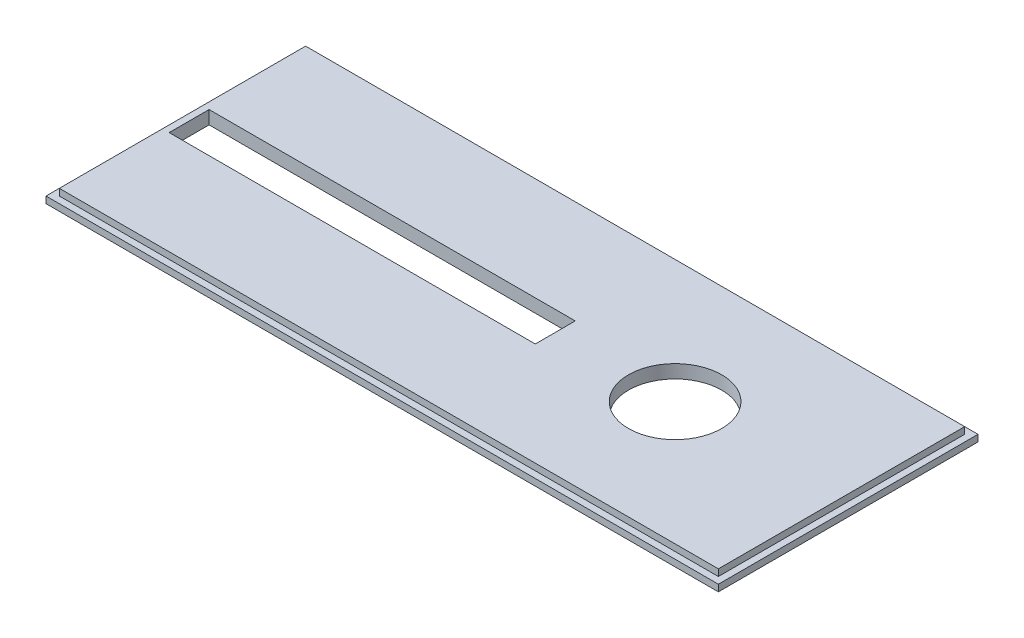
from build123d import *

# Parameters (mm, degrees)
SKETCH2_W           = 101
SKETCH2_H           = 39
BOSS_EXTRUDE1_DEPTH = 1
SKETCH3_W           = 99
SKETCH3_H           = 37
BOSS_EXTRUDE2_DEPTH = 1
SKETCH4_R           = 7
CUT_EXTRUDE1_DEPTH  = 2
CUT_EXTRUDE2_DEPTH  = 0.2


with BuildPart() as part:
    # Sketch2 → Boss-Extrude1 (new body)
    with BuildSketch(Plane(origin=(0, 0, 0), x_dir=(1, 0, 0), z_dir=(0, 1, 0))):
        with Locations((50.5, 19.5)):
            Rectangle(SKETCH2_W, SKETCH2_H)
    extrude(amount=BOSS_EXTRUDE1_DEPTH)

    # Sketch3 → Boss-Extrude2 (add)
    with BuildSketch(Plane(origin=(0, 1, 0), x_dir=(1, 0, 0), z_dir=(0, 1, 0))):
        with Locations((50.5, 19.5)):
            Rectangle(SKETCH3_W, SKETCH3_H)
    extrude(amount=BOSS_EXTRUDE2_DEPTH)

    # Sketch4 → Cut-Extrude1 (cut)
    with BuildSketch(Plane(origin=(0, 2, 0), x_dir=(1, 0, 0), z_dir=(0, 1, 0))):
        with Locations(Location((75, 19.5, 0), (0, 0, 270))):
            Circle(SKETCH4_R)
        Polygon((2, 19.5), (2, 22.5), (57, 22.5), (57, 16.5), (2, 16.5), align=None)
    extrude(amount=-CUT_EXTRUDE1_DEPTH, mode=Mode.SUBTRACT)

    # Sketch5 → Cut-Extrude2 (cut)
    # profile 1 of 13: a face of its own
    with BuildSketch(Plane.XZ):
        Polygon((5.437038124, -7.674955241), (7.777582996, -7.674955241), (7.777582996, -8.132887933), (5.945852227, -8.132887933), (5.945852227, -9.252278959), (7.777582996, -9.252278959), (7.777582996, -9.710211651), (5.945852227, -9.710211651), (5.945852227, -11.185772549), (7.777582996, -11.185772549), (7.777582996, -11.643705241), (5.437038124, -11.643705241), align=None)
    # profile 2 of 13: a face of its own
    with BuildSketch(Plane.XZ):
        with BuildLine():
            Line((12.153384278, -8.41273569), (11.74792304, -8.692583446))
            add(Edge.make_bspline(
                [(11.74792304, -8.692583446), (11.699360519, -8.639390419), (11.604293587, -8.535258717), (11.447741833, -8.398852612), (11.283903862, -8.284045488), (11.112548974, -8.191219567), (10.933495748, -8.118551578), (10.745802345, -8.068059473), (10.549272674, -8.036942328), (10.415317675, -8.033088084), (10.347094214, -8.031125113)],
                knots=[0, 0, 0, 0, 1.078723025, 2.111729107, 3.104379151, 4.071093171, 5.02612831, 5.993405043, 6.978038489, 8, 8, 8, 8], degree=3))
            add(Edge.make_bspline(
                [(10.347094214, -8.031125113), (10.311552887, -8.031637396), (10.240846985, -8.032656533), (10.136069164, -8.043861225), (10.032893996, -8.059197322), (9.931418553, -8.082498939), (9.831823107, -8.112961451), (9.733429062, -8.148288704), (9.637726478, -8.192045026), (9.543786966, -8.240679904), (9.453020008, -8.295383363), (9.367525595, -8.356141299), (9.285748273, -8.420238831), (9.210000019, -8.490706494), (9.139589571, -8.566307555), (9.072974566, -8.646090641), (9.0118387, -8.731093502), (8.956416956, -8.821061306), (8.905863851, -8.914653562), (8.863438944, -9.012556212), (8.826606094, -9.113108419), (8.796039794, -9.216833773), (8.77343275, -9.324046456), (8.756669942, -9.434454634), (8.745927793, -9.547813754), (8.744865472, -9.624590343), (8.744329791, -9.663305351)],
                knots=[0, 0, 0, 0, 1.002068956, 1.993515617, 2.969284448, 3.943018425, 4.926742606, 5.905741285, 6.889351865, 7.892340394, 8.888397413, 9.875523532, 10.849114049, 11.817064186, 12.790109362, 13.76151668, 14.746886598, 15.740472426, 16.740336546, 17.744438579, 18.747064952, 19.759451636, 20.791569268, 21.834966327, 22.908270136, 24, 24, 24, 24], degree=3))
            add(Edge.make_bspline(
                [(8.744329791, -9.663305351), (8.745556182, -9.721420952), (8.747956881, -9.835184004), (8.771160957, -10.001761733), (8.807367507, -10.160504507), (8.858262996, -10.311399788), (8.924025997, -10.45427616), (9.004481465, -10.588898893), (9.100092364, -10.715596236), (9.20927368, -10.832730533), (9.328291627, -10.940229594), (9.45728559, -11.032204597), (9.591838383, -11.112072765), (9.734609332, -11.175487352), (9.883580968, -11.225921905), (10.039906248, -11.261647802), (10.203099575, -11.283568031), (10.314429168, -11.286199515), (10.370944875, -11.287535369)],
                knots=[0, 0, 0, 0, 1.083728652, 2.12143175, 3.131304262, 4.117911469, 5.086904967, 6.060353746, 7.03835, 8.042493243, 9.043967071, 10.025107856, 10.993520914, 11.958418665, 12.934074928, 13.923564625, 14.94591178, 16, 16, 16, 16], degree=3))
            add(Edge.make_bspline(
                [(10.370944875, -11.287535369), (10.436527525, -11.285607548), (10.566057471, -11.281799979), (10.756515139, -11.24972865), (10.94002588, -11.197927791), (11.116787832, -11.124904734), (11.28694527, -11.031376994), (11.449698824, -10.916625442), (11.60595556, -10.781687717), (11.700933467, -10.67873542), (11.749513084, -10.626077036)],
                knots=[0, 0, 0, 0, 0.996377973, 1.967910503, 2.926842387, 3.889624876, 4.868586907, 5.872161968, 6.91164629, 8, 8, 8, 8], degree=3))
            Line((11.749513084, -10.626077036), (12.153384278, -10.904334748))
            add(Edge.make_bspline(
                [(12.153384278, -10.904334748), (12.127239388, -10.937490895), (12.075292891, -11.003367848), (11.991403183, -11.096548242), (11.903287567, -11.184184035), (11.810078328, -11.26546235), (11.711875191, -11.340304133), (11.609138281, -11.409575972), (11.501966323, -11.473167687), (11.390417869, -11.530398804), (11.275128399, -11.58162139), (11.15586253, -11.624756805), (11.033763304, -11.662809309), (10.90775412, -11.692600207), (10.778326885, -11.716744892), (10.645281148, -11.732950941), (10.509198658, -11.743919835), (10.41734333, -11.744948471), (10.370944875, -11.745468062)],
                knots=[0, 0, 0, 0, 0.990136069, 1.967271632, 2.938597646, 3.903378639, 4.8655934, 5.832714132, 6.808088679, 7.786607084, 8.77175572, 9.76479442, 10.759640537, 11.769709565, 12.799869661, 13.846050076, 14.911985293, 16, 16, 16, 16], degree=3))
            add(Edge.make_bspline(
                [(10.370944875, -11.745468062), (10.328259188, -11.745178779), (10.244117959, -11.744608552), (10.119769875, -11.735027673), (9.998716951, -11.722072103), (9.881285482, -11.702635602), (9.766921348, -11.679360112), (9.656558027, -11.648499585), (9.548698199, -11.614075179), (9.444911232, -11.572443671), (9.344414578, -11.52614739), (9.246854702, -11.47540747), (9.153191397, -11.418157061), (9.063346697, -11.354952211), (8.976263065, -11.287384055), (8.892821252, -11.213948165), (8.812153072, -11.135579686), (8.762259922, -11.079043915), (8.737174592, -11.050618803)],
                knots=[0, 0, 0, 0, 1.116169561, 2.200172621, 3.260333751, 4.299600589, 5.312386579, 6.311224183, 7.295427787, 8.272379731, 9.233840239, 10.188782295, 11.146938977, 12.102635432, 13.060741968, 14.028403985, 15.00871894, 16, 16, 16, 16], degree=3))
            add(Edge.make_bspline(
                [(8.737174592, -11.050618803), (8.696961878, -11.00126552), (8.617253588, -10.903439103), (8.515664104, -10.744427439), (8.428040569, -10.578929216), (8.358420201, -10.4045865), (8.303390855, -10.223455403), (8.263282112, -10.034983227), (8.240171984, -9.83852527), (8.237085127, -9.704971728), (8.235515688, -9.637069624)],
                knots=[0, 0, 0, 0, 0.995996121, 1.974230005, 2.94855815, 3.923972302, 4.908363682, 5.909282248, 6.937024559, 8, 8, 8, 8], degree=3))
            add(Edge.make_bspline(
                [(8.235515688, -9.637069624), (8.237287514, -9.56568592), (8.240773471, -9.425242939), (8.270131706, -9.219077395), (8.317967332, -9.021860036), (8.383716139, -8.832739826), (8.470840046, -8.65326405), (8.574740148, -8.481113514), (8.700391258, -8.319495823), (8.841610149, -8.167011424), (8.996980492, -8.027460943), (9.164768736, -7.906448105), (9.341391793, -7.803036582), (9.527500116, -7.718323623), (9.723597986, -7.652698146), (9.929361218, -7.607298131), (10.144348626, -7.578550655), (10.290820035, -7.574999896), (10.365379721, -7.573192421)],
                knots=[0, 0, 0, 0, 1.034323922, 2.034967744, 3.011348252, 3.972313581, 4.931003742, 5.898099022, 6.881526582, 7.89265862, 8.907395938, 9.903191422, 10.886146247, 11.869423756, 12.861842533, 13.877618994, 14.91962492, 16, 16, 16, 16], degree=3))
            add(Edge.make_bspline(
                [(10.365379721, -7.573192421), (10.412305032, -7.57373577), (10.505212766, -7.574811551), (10.642959122, -7.585440767), (10.777209875, -7.602887639), (10.907991833, -7.62691987), (11.035692091, -7.656616524), (11.159634798, -7.695338439), (11.280522258, -7.739573282), (11.397540742, -7.790644657), (11.510403101, -7.847459126), (11.617829797, -7.911553126), (11.720563127, -7.980466709), (11.817784213, -8.055636256), (11.91014105, -8.13582237), (11.997182587, -8.221947993), (12.078455321, -8.314362414), (12.128324333, -8.379834807), (12.153384278, -8.41273569)],
                knots=[0, 0, 0, 0, 1.097463626, 2.172875475, 3.229307817, 4.262776093, 5.282168658, 6.293918414, 7.298043722, 8.291879901, 9.278790577, 10.251524626, 11.216027204, 12.170719329, 13.124142787, 14.075306658, 15.032812027, 16, 16, 16, 16], degree=3))
        make_face()
    # profile 3 of 13: a face of its own
    with BuildSketch(Plane.XZ):
        Polygon((12.967486842, -7.674955241), (15.308031714, -7.674955241), (15.308031714, -8.132887933), (13.476300945, -8.132887933), (13.476300945, -9.252278959), (15.308031714, -9.252278959), (15.308031714, -9.710211651), (13.476300945, -9.710211651), (13.476300945, -11.185772549), (15.308031714, -11.185772549), (15.308031714, -11.643705241), (12.967486842, -11.643705241), align=None)
    # profile 4 of 13: a face of its own
    with BuildSketch(Plane.XZ):
        Polygon((18.057217912, -7.674955241), (18.920611842, -7.674955241), (18.920611842, -11.643705241), (18.411797739, -11.643705241), (18.411797739, -8.132887933), (17.801220816, -8.132887933), align=None)
    # profile 5 of 13: a face of its own
    with BuildSketch(Plane.XZ):
        with BuildLine():
            Line((21.252411471, -11.745468062), (20.873185961, -11.510936561))
            Line((20.873185961, -11.510936561), (21.932950334, -9.977339055))
            add(Edge.make_bspline(
                [(21.932950334, -9.977339055), (21.907321436, -9.983308805), (21.853791418, -9.995777575), (21.768122152, -10.007046591), (21.674695895, -10.014271073), (21.609656943, -10.01508087), (21.57598544, -10.015500113)],
                knots=[0, 0, 0, 0, 0.876990432, 1.831733655, 2.877460594, 4, 4, 4, 4], degree=3))
            add(Edge.make_bspline(
                [(21.57598544, -10.015500113), (21.534066502, -10.014380789), (21.451249951, -10.012169414), (21.329528534, -9.996148983), (21.212572572, -9.969143164), (21.100873334, -9.930606739), (20.993610629, -9.88205586), (20.891356502, -9.822016104), (20.794212684, -9.750794237), (20.702693414, -9.670196442), (20.618558378, -9.582215186), (20.546251611, -9.486700388), (20.483391825, -9.387444849), (20.433538476, -9.282229309), (20.392889835, -9.172878855), (20.365657982, -9.057774015), (20.34829361, -8.93771668), (20.346304321, -8.855889926), (20.345291329, -8.814221818)],
                knots=[0, 0, 0, 0, 1.049645559, 2.073717244, 3.068620023, 4.050868799, 5.0280146, 6.012614837, 7.014861962, 8.040029866, 9.063477688, 10.05771615, 11.035582925, 12.000321245, 12.968227545, 13.951753526, 14.956984712, 16, 16, 16, 16], degree=3))
            add(Edge.make_bspline(
                [(20.345291329, -8.814221818), (20.347189662, -8.757361494), (20.350918306, -8.645678252), (20.38296114, -8.482785474), (20.434718634, -8.328597815), (20.507617106, -8.184309882), (20.598950816, -8.050761814), (20.709872778, -7.932032079), (20.83707772, -7.826394297), (20.980129847, -7.737036424), (21.13424013, -7.663956932), (21.295773265, -7.611176947), (21.462873815, -7.579014131), (21.576109559, -7.575144373), (21.633227026, -7.573192421)],
                knots=[0, 0, 0, 0, 1.026406161, 2.016034366, 2.986473729, 3.956357911, 4.927092453, 5.899372274, 6.881969593, 7.906050784, 8.938290869, 9.955669438, 10.968815142, 12, 12, 12, 12], degree=3))
            add(Edge.make_bspline(
                [(21.633227026, -7.573192421), (21.692998628, -7.575063371), (21.811029408, -7.57875793), (21.983989293, -7.611628751), (22.149441979, -7.665146202), (22.305172852, -7.739868115), (22.449009432, -7.831751581), (22.577564084, -7.939102227), (22.686787834, -8.063557914), (22.777519008, -8.200572101), (22.849712533, -8.346283216), (22.901967007, -8.497128364), (22.934255266, -8.651460594), (22.938248849, -8.755769536), (22.940243252, -8.807861641)],
                knots=[0, 0, 0, 0, 1.075354337, 2.123498557, 3.157086714, 4.198574184, 5.224335365, 6.223199331, 7.20350914, 8.194696859, 9.174135401, 10.123259326, 11.062751755, 12, 12, 12, 12], degree=3))
            add(Edge.make_bspline(
                [(22.940243252, -8.807861641), (22.938821916, -8.848454794), (22.935939031, -8.930789573), (22.918370652, -9.055614402), (22.886058511, -9.182241742), (22.851801583, -9.290124347), (22.815859835, -9.378943786), (22.784062602, -9.451069969), (22.745908117, -9.526687226), (22.702197115, -9.606576181), (22.655456972, -9.691746657), (22.600375434, -9.779634248), (22.542112685, -9.872930183), (22.499989003, -9.93558914), (22.47833545, -9.967798791)],
                knots=[0, 0, 0, 0, 1.152952784, 2.338525269, 3.5705256, 4.860373011, 5.549303084, 6.290464991, 7.098171277, 7.95341765, 8.876586292, 9.856184562, 10.897978041, 12, 12, 12, 12], degree=3))
            Line((22.47833545, -9.967798791), (21.252411471, -11.745468062))
        make_face()
        with BuildLine():
            add(Edge.make_bspline(
                [(21.645152357, -9.557567421), (21.673817653, -9.557145604), (21.729790827, -9.556321946), (21.81165288, -9.544331591), (21.889348256, -9.527145539), (21.963349492, -9.503750799), (22.032017811, -9.47093043), (22.097591041, -9.433293973), (22.158392291, -9.387300555), (22.214352882, -9.335127641), (22.265007028, -9.278022585), (22.309710905, -9.217759272), (22.347246387, -9.154252444), (22.378948852, -9.088331352), (22.401215158, -9.018491912), (22.419357262, -8.946693708), (22.429815715, -8.871506652), (22.430885449, -8.820348016), (22.43142915, -8.794346267)],
                knots=[0, 0, 0, 0, 1.121582496, 2.190053483, 3.232400525, 4.236647434, 5.220963389, 6.207028463, 7.192929689, 8.198944593, 9.198677044, 10.178386704, 11.132364257, 12.084081197, 13.035798136, 13.997310019, 14.982118228, 16, 16, 16, 16], degree=3))
            add(Edge.make_bspline(
                [(22.43142915, -8.794346267), (22.430625856, -8.768599497), (22.42903657, -8.717660487), (22.41759055, -8.642812879), (22.399405551, -8.570482105), (22.37315519, -8.501433069), (22.33906878, -8.435196753), (22.297796248, -8.371788843), (22.24898018, -8.311149471), (22.193554121, -8.254258579), (22.13308337, -8.202465814), (22.068826295, -8.156469144), (22.001229587, -8.117540127), (21.930296828, -8.085290431), (21.855890975, -8.061860501), (21.778825091, -8.04423237), (21.698514689, -8.032467853), (21.643604239, -8.031577153), (21.615736542, -8.031125113)],
                knots=[0, 0, 0, 0, 0.99485033, 1.968273718, 2.919732649, 3.872789051, 4.816442427, 5.793738012, 6.791904607, 7.820456554, 8.859208763, 9.865331505, 10.8702544, 11.869681439, 12.870576991, 13.87935517, 14.923747887, 16, 16, 16, 16], degree=3))
            add(Edge.make_bspline(
                [(21.615736542, -8.031125113), (21.590783972, -8.031641093), (21.541452008, -8.0326612), (21.468855889, -8.043659813), (21.398372879, -8.059930441), (21.330506253, -8.084476474), (21.26426816, -8.114119811), (21.201273197, -8.152477168), (21.139714676, -8.195763257), (21.082393861, -8.24661391), (21.029171653, -8.301920832), (20.981991361, -8.361235767), (20.943169375, -8.424891707), (20.909479096, -8.491141735), (20.88571597, -8.562355787), (20.866771314, -8.636360516), (20.856724486, -8.714307942), (20.854990746, -8.767291048), (20.854105432, -8.794346267)],
                knots=[0, 0, 0, 0, 0.997303855, 1.971699086, 2.930693632, 3.886166766, 4.85379267, 5.828187901, 6.831221175, 7.860297234, 8.887406069, 9.898917088, 10.884320193, 11.865609815, 12.864602205, 13.880104296, 14.917499442, 16, 16, 16, 16], degree=3))
            add(Edge.make_bspline(
                [(20.854105432, -8.794346267), (20.854886991, -8.821419292), (20.8564186, -8.874473811), (20.867904411, -8.951950617), (20.885884671, -9.025973371), (20.912818148, -9.095896044), (20.945000462, -9.163782423), (20.98695675, -9.226775917), (21.034646306, -9.287368342), (21.090503549, -9.342039457), (21.150069238, -9.393012402), (21.214032862, -9.436252202), (21.279424737, -9.47460682), (21.348032218, -9.504222509), (21.418516852, -9.528901412), (21.491943647, -9.54501135), (21.567700608, -9.556034687), (21.619140958, -9.557052667), (21.645152357, -9.557567421)],
                knots=[0, 0, 0, 0, 1.061595758, 2.080390103, 3.066193108, 4.043187242, 5.014857721, 6.006725919, 7.00516375, 8.034247875, 9.067105391, 10.076308362, 11.058817295, 12.036198478, 13.002683705, 13.983651619, 14.980410447, 16, 16, 16, 16], degree=3))
        make_face(mode=Mode.SUBTRACT)
    # profile 6 of 13: a face of its own
    with BuildSketch(Plane.XZ):
        with BuildLine():
            Line((25.27522297, -7.573192421), (25.670348921, -7.810108987))
            Line((25.670348921, -7.810108987), (24.606609438, -9.339731383))
            add(Edge.make_bspline(
                [(24.606609438, -9.339731383), (24.625864046, -9.334060058), (24.667576881, -9.321773803), (24.737134569, -9.310351224), (24.817717093, -9.304595073), (24.875051986, -9.303658407), (24.905537723, -9.303160369)],
                knots=[0, 0, 0, 0, 0.796048766, 1.724545677, 2.790110166, 4, 4, 4, 4], degree=3))
            add(Edge.make_bspline(
                [(24.905537723, -9.303160369), (24.949052713, -9.304194241), (25.034558112, -9.306225761), (25.159718981, -9.32324683), (25.279250166, -9.351190529), (25.393389152, -9.390071253), (25.50179475, -9.440675425), (25.605301002, -9.500904956), (25.701868978, -9.574371505), (25.792180068, -9.657239914), (25.875536293, -9.746723271), (25.947132455, -9.842941648), (26.008818075, -9.942448188), (26.059640859, -10.046358223), (26.097413524, -10.155219448), (26.125501333, -10.267700486), (26.142699687, -10.384656345), (26.144737402, -10.464099551), (26.145772098, -10.504438665)],
                knots=[0, 0, 0, 0, 1.085768624, 2.13349656, 3.1458852, 4.145750037, 5.137155722, 6.127501693, 7.128940571, 8.158980511, 9.184145427, 10.176323106, 11.147419034, 12.102959344, 13.056918676, 14.017869493, 14.993527694, 16, 16, 16, 16], degree=3))
            add(Edge.make_bspline(
                [(26.145772098, -10.504438665), (26.143822457, -10.559444818), (26.139986871, -10.667659995), (26.108436778, -10.826125091), (26.058508706, -10.977705302), (25.987271545, -11.120925686), (25.89729959, -11.254901222), (25.786436315, -11.375431887), (25.656775703, -11.48275246), (25.510870171, -11.575739854), (25.351950915, -11.650937339), (25.184221329, -11.705353065), (25.009446303, -11.739121906), (24.890318326, -11.743335141), (24.83001063, -11.745468062)],
                knots=[0, 0, 0, 0, 0.981999396, 1.931915476, 2.875165147, 3.825883243, 4.780566088, 5.74908454, 6.740839944, 7.779754303, 8.832355466, 9.872951476, 10.923196738, 12, 12, 12, 12], degree=3))
            add(Edge.make_bspline(
                [(24.83001063, -11.745468062), (24.775278568, -11.743465884), (24.666825805, -11.739498527), (24.507512813, -11.708225967), (24.354438529, -11.657856762), (24.208908986, -11.588178003), (24.074750966, -11.49917067), (23.954289923, -11.393334759), (23.849080104, -11.271117343), (23.760631584, -11.133998348), (23.690445222, -10.985979876), (23.638832711, -10.831283407), (23.607768467, -10.671044226), (23.60373317, -10.562344175), (23.601701586, -10.507618753)],
                knots=[0, 0, 0, 0, 1.013919762, 2.009103873, 2.997048414, 3.994509061, 4.990420291, 5.971920342, 6.957603089, 7.969950955, 8.9872563, 9.986070715, 10.986080238, 12, 12, 12, 12], degree=3))
            add(Edge.make_bspline(
                [(23.601701586, -10.507618753), (23.603026135, -10.465686472), (23.605712342, -10.380647145), (23.624782554, -10.252077028), (23.655943133, -10.121223884), (23.692616704, -10.01127277), (23.728201678, -9.920410901), (23.761127088, -9.848646936), (23.797587944, -9.772909233), (23.838911258, -9.693978018), (23.886203094, -9.612574008), (23.937023731, -9.526861201), (23.993519039, -9.438415431), (24.033060785, -9.378374093), (24.053274102, -9.347681603)],
                knots=[0, 0, 0, 0, 1.194305989, 2.422071347, 3.694670561, 5.022004315, 5.720134447, 6.47362152, 7.270449589, 8.114647718, 9.010750929, 9.951985565, 10.953076949, 12, 12, 12, 12], degree=3))
            Line((24.053274102, -9.347681603), (25.27522297, -7.573192421))
        make_face()
        with BuildLine():
            add(Edge.make_bspline(
                [(24.826830542, -9.761093062), (24.802408825, -9.761615082), (24.754133584, -9.762646977), (24.683350835, -9.773515495), (24.615028831, -9.789982356), (24.549841927, -9.814049594), (24.487494273, -9.844365622), (24.428017353, -9.8813217), (24.371445559, -9.925443155), (24.31794224, -9.975526756), (24.26985972, -10.031400292), (24.226014478, -10.090178397), (24.190453084, -10.153972889), (24.161991286, -10.22139031), (24.138407518, -10.291953154), (24.121906611, -10.366525172), (24.112272861, -10.445087108), (24.111109761, -10.498581236), (24.110515688, -10.525904259)],
                knots=[0, 0, 0, 0, 1.000668136, 1.978054791, 2.929484158, 3.878303629, 4.821130496, 5.767956646, 6.743892455, 7.758622191, 8.767575263, 9.763037712, 10.760455477, 11.753542685, 12.760386935, 13.807023548, 14.879900473, 16, 16, 16, 16], degree=3))
            add(Edge.make_bspline(
                [(24.110515688, -10.525904259), (24.111032756, -10.552971353), (24.11204556, -10.605988913), (24.12277901, -10.683728667), (24.139960144, -10.757884033), (24.165124756, -10.828238968), (24.195841108, -10.895443652), (24.2345671, -10.958703185), (24.279931007, -11.018292076), (24.331366417, -11.07362889), (24.387621805, -11.123604874), (24.447297667, -11.166977161), (24.508204833, -11.205021235), (24.572339934, -11.23439194), (24.637834474, -11.258584091), (24.706157563, -11.275022473), (24.776386794, -11.285995265), (24.8241378, -11.287017963), (24.848296137, -11.287535369)],
                knots=[0, 0, 0, 0, 1.099969797, 2.154561419, 3.184363179, 4.189745603, 5.187708984, 6.183808971, 7.198903794, 8.22825443, 9.251098181, 10.253299465, 11.225387826, 12.165412448, 13.116428293, 14.059905273, 15.018461259, 16, 16, 16, 16], degree=3))
            add(Edge.make_bspline(
                [(24.848296137, -11.287535369), (24.875107524, -11.28709407), (24.927914897, -11.286224894), (25.00554086, -11.274241799), (25.08027545, -11.256897969), (25.152410119, -11.233566401), (25.220289902, -11.200792102), (25.285949099, -11.162614522), (25.348854786, -11.117447548), (25.407058788, -11.064852608), (25.460984269, -11.008336052), (25.5079056, -10.947723558), (25.548118222, -10.884524025), (25.580980965, -10.818534865), (25.605440435, -10.749227675), (25.624267559, -10.677543902), (25.63427257, -10.602505519), (25.636055938, -10.551635296), (25.636957996, -10.525904259)],
                knots=[0, 0, 0, 0, 1.054506433, 2.076942642, 3.08409574, 4.073807639, 5.053850104, 6.045100359, 7.061397357, 8.095844899, 9.129029121, 10.132772442, 11.10813953, 12.073918953, 13.02762105, 13.996719216, 14.986705996, 16, 16, 16, 16], degree=3))
            add(Edge.make_bspline(
                [(25.636957996, -10.525904259), (25.636168175, -10.499891586), (25.63461341, -10.448685535), (25.623057942, -10.373322361), (25.604900801, -10.300834898), (25.579421416, -10.231101416), (25.54585288, -10.164606664), (25.503749388, -10.101962475), (25.456251972, -10.040774625), (25.400600271, -9.984602117), (25.340923398, -9.931854752), (25.276123628, -9.886960282), (25.209216111, -9.847436256), (25.139002895, -9.815299394), (25.065174005, -9.791689766), (24.98857436, -9.774309974), (24.90882184, -9.762416034), (24.854435195, -9.761538477), (24.826830542, -9.761093062)],
                knots=[0, 0, 0, 0, 1.007406841, 1.98308429, 2.946696416, 3.898367138, 4.853354566, 5.824321577, 6.818405618, 7.849339281, 8.882723662, 9.899554728, 10.89792352, 11.890309722, 12.883757414, 13.89487152, 14.931514512, 16, 16, 16, 16], degree=3))
        make_face(mode=Mode.SUBTRACT)
    # profile 7 of 13: a face of its own
    with BuildSketch(Plane.XZ):
        Polygon((28.079265688, -7.674955241), (28.591259879, -7.674955241), (29.857729981, -10.719094614), (31.123405061, -7.674955241), (31.640964406, -7.674955241), (29.938822229, -11.643705241), (29.775842711, -11.643705241), align=None)
    # profile 8 of 13: a face of its own
    with BuildSketch(Plane.XZ):
        with BuildLine():
            Line((32.200659919, -7.674955241), (32.709474022, -7.674955241))
            Line((32.709474022, -7.674955241), (32.709474022, -10.071151655))
            add(Edge.make_bspline(
                [(32.709474022, -10.071151655), (32.709416674, -10.104542588), (32.70930835, -10.167615534), (32.710026319, -10.257194404), (32.711759631, -10.33642654), (32.713396821, -10.405856693), (32.714682649, -10.464974243), (32.716987131, -10.514022704), (32.720059637, -10.552723706), (32.722674956, -10.575200753), (32.723784418, -10.58473589)],
                knots=[0, 0, 0, 0, 1.55908667, 2.944996726, 4.182614548, 5.259411187, 6.187768874, 6.943477064, 7.551805389, 8, 8, 8, 8], degree=3))
            add(Edge.make_bspline(
                [(32.723784418, -10.58473589), (32.72942908, -10.622234709), (32.740224248, -10.693949544), (32.767035087, -10.79497179), (32.803016163, -10.88406209), (32.846897059, -10.963194274), (32.902928044, -11.032577221), (32.969893227, -11.094265314), (33.048576129, -11.1498172), (33.136682838, -11.197865199), (33.230629658, -11.236932347), (33.325910253, -11.265866357), (33.421087753, -11.284468515), (33.484803608, -11.286518235), (33.516421387, -11.287535369)],
                knots=[0, 0, 0, 0, 1.166957714, 2.231755086, 3.208991316, 4.118778005, 5.006904847, 5.942163703, 6.913386956, 7.965005362, 9.025668557, 10.040039382, 11.027406897, 12, 12, 12, 12], degree=3))
            add(Edge.make_bspline(
                [(33.516421387, -11.287535369), (33.546425419, -11.286636282), (33.605983742, -11.284851585), (33.693978655, -11.269975546), (33.779578806, -11.246113017), (33.862141631, -11.21258849), (33.940721117, -11.170805434), (34.012974998, -11.120533419), (34.079122416, -11.063551712), (34.138373232, -10.998882304), (34.189803164, -10.925787912), (34.235730309, -10.846451547), (34.272110674, -10.758723561), (34.290767049, -10.697271719), (34.300313114, -10.665828138)],
                knots=[0, 0, 0, 0, 0.999732249, 1.98447917, 2.96624928, 3.957159324, 4.949250196, 5.927077037, 6.885351415, 7.854639871, 8.842631176, 9.859548065, 10.904776923, 12, 12, 12, 12], degree=3))
            add(Edge.make_bspline(
                [(34.300313114, -10.665828138), (34.303373766, -10.652341608), (34.310176504, -10.622365862), (34.317843286, -10.572187287), (34.324058459, -10.512493174), (34.328519477, -10.442992289), (34.332413288, -10.363745244), (34.335761569, -10.274702464), (34.337029503, -10.17609787), (34.337456046, -10.107192627), (34.33767915, -10.071151655)],
                knots=[0, 0, 0, 0, 0.555909564, 1.235588686, 2.039259232, 2.968460287, 4.03530762, 5.229446682, 6.550858702, 8, 8, 8, 8], degree=3))
            Line((34.33767915, -10.071151655), (34.33767915, -7.674955241))
            Line((34.33767915, -7.674955241), (34.846493252, -7.674955241))
            Line((34.846493252, -7.674955241), (34.846493252, -10.063201435))
            add(Edge.make_bspline(
                [(34.846493252, -10.063201435), (34.846200322, -10.105342145), (34.845627162, -10.187796499), (34.840801774, -10.308428537), (34.832958324, -10.422970022), (34.821974566, -10.531448475), (34.807357905, -10.633975689), (34.791402367, -10.731020207), (34.77046658, -10.821671774), (34.746705155, -10.907061157), (34.717970925, -10.988294723), (34.682718048, -11.06678294), (34.640554358, -11.143167351), (34.59104388, -11.217327142), (34.534333875, -11.288782025), (34.471123813, -11.358376462), (34.401120099, -11.425638005), (34.325564604, -11.490713102), (34.24371914, -11.550484198), (34.156580639, -11.602898321), (34.064403493, -11.646933141), (33.967651913, -11.682483462), (33.866573541, -11.711633352), (33.760554558, -11.730925061), (33.650017809, -11.743358052), (33.574758236, -11.74475444), (33.536296938, -11.745468062)],
                knots=[0, 0, 0, 0, 1.249746778, 2.445309111, 3.579791402, 4.654321124, 5.678008809, 6.650959404, 7.569940487, 8.435761916, 9.278480968, 10.122774478, 10.984627263, 11.863091158, 12.76404959, 13.687656952, 14.649240315, 15.641521383, 16.642911538, 17.65112545, 18.653008962, 19.667635542, 20.705108869, 21.768718231, 22.859706637, 24, 24, 24, 24], degree=3))
            add(Edge.make_bspline(
                [(33.536296938, -11.745468062), (33.497587691, -11.74457499), (33.421358298, -11.742816281), (33.309153733, -11.732802499), (33.20132783, -11.714281022), (33.097703377, -11.688823909), (32.997766444, -11.656483031), (32.902518603, -11.615328925), (32.810398431, -11.568982553), (32.724379596, -11.513661837), (32.642918564, -11.453862572), (32.569369025, -11.387202), (32.500739565, -11.317698963), (32.441650602, -11.241343629), (32.387609362, -11.161877177), (32.341819787, -11.07689978), (32.301143401, -10.988043605), (32.281377453, -10.925511174), (32.27141688, -10.893999462)],
                knots=[0, 0, 0, 0, 1.133329185, 2.231843898, 3.29426245, 4.332905112, 5.353485079, 6.365031746, 7.367763869, 8.368573437, 9.35539345, 10.32243748, 11.271609842, 12.210613971, 13.14444413, 14.081844494, 15.03339173, 16, 16, 16, 16], degree=3))
            add(Edge.make_bspline(
                [(32.27141688, -10.893999462), (32.265555668, -10.872869638), (32.25291218, -10.827289535), (32.239153303, -10.752003975), (32.227657301, -10.665201957), (32.216983602, -10.566901654), (32.210562569, -10.457048814), (32.205001524, -10.335934965), (32.200626789, -10.203420709), (32.200648585, -10.111171607), (32.200659919, -10.063201435)],
                knots=[0, 0, 0, 0, 0.629181127, 1.357235188, 2.194217397, 3.14266044, 4.194662557, 5.352158634, 6.623104138, 8, 8, 8, 8], degree=3))
            Line((32.200659919, -10.063201435), (32.200659919, -7.674955241))
        make_face()
    # profile 9 of 13: a face of its own
    with BuildSketch(Plane.XZ):
        Polygon((37.136156714, -11.643705241), (37.666436411, -7.674955241), (37.866781964, -7.674955241), (39.371758677, -10.829602677), (40.87673539, -7.674955241), (41.080261031, -7.674955241), (41.613720816, -11.643705241), (41.108881824, -11.643705241), (40.75589204, -8.845227677), (39.467956343, -11.643705241), (39.275561011, -11.643705241), (37.991600424, -8.845227677), (37.640200684, -11.643705241), align=None)
    # profile 10 of 13: a face of its own
    with BuildSketch(Plane.XZ):
        with BuildLine():
            Line((44.649909969, -10.626077036), (45.073656714, -10.828807655))
            add(Edge.make_bspline(
                [(45.073656714, -10.828807655), (45.046866957, -10.877494665), (44.994696291, -10.972308284), (44.905673911, -11.10323503), (44.80906211, -11.218377777), (44.705799926, -11.319010866), (44.594599076, -11.405110543), (44.477461021, -11.481495183), (44.351901273, -11.545543306), (44.219531338, -11.600289522), (44.078613621, -11.642418768), (43.929321612, -11.672347992), (43.771350237, -11.690991841), (43.66307526, -11.693369326), (43.607636081, -11.694586651)],
                knots=[0, 0, 0, 0, 1.110387997, 2.162381809, 3.158716456, 4.110235088, 5.03849693, 5.965639636, 6.901458115, 7.851707839, 8.825366416, 9.836184406, 10.892078622, 12, 12, 12, 12], degree=3))
            add(Edge.make_bspline(
                [(43.607636081, -11.694586651), (43.548988145, -11.6933784), (43.434427596, -11.69101825), (43.267908428, -11.667818694), (43.11078209, -11.632711758), (42.963617774, -11.581865874), (42.826983511, -11.515084924), (42.69924893, -11.435346641), (42.581915254, -11.340172786), (42.476102956, -11.23116603), (42.382109717, -11.113437406), (42.298104509, -10.991625031), (42.229394374, -10.864506761), (42.171361728, -10.734536113), (42.126690069, -10.600311315), (42.095039816, -10.462420781), (42.075164267, -10.32057233), (42.072833543, -10.224656354), (42.071653509, -10.176094564)],
                knots=[0, 0, 0, 0, 1.164566152, 2.274817246, 3.333639364, 4.359360714, 5.360157823, 6.349126428, 7.344925074, 8.35392925, 9.361228562, 10.335284257, 11.289572886, 12.22779236, 13.160187688, 14.095091993, 15.035554391, 16, 16, 16, 16], degree=3))
            add(Edge.make_bspline(
                [(42.071653509, -10.176094564), (42.0726867, -10.130723079), (42.074736008, -10.040729846), (42.092214657, -9.907823071), (42.118859918, -9.778436175), (42.157241826, -9.653098164), (42.206915885, -9.531588437), (42.267509385, -9.413737985), (42.339063677, -9.299579762), (42.394351906, -9.227991118), (42.422258226, -9.191857284)],
                knots=[0, 0, 0, 0, 1.021096707, 2.025320431, 3.012923591, 3.992437812, 4.971861174, 5.964497656, 6.972595394, 8, 8, 8, 8], degree=3))
            add(Edge.make_bspline(
                [(42.422258226, -9.191857284), (42.459996169, -9.148015589), (42.534379076, -9.061601956), (42.661142128, -8.949206618), (42.79699122, -8.853575597), (42.942821432, -8.77637937), (43.097551545, -8.715043838), (43.262065132, -8.672636411), (43.435876146, -8.646616665), (43.554806532, -8.643364213), (43.615586301, -8.641702036)],
                knots=[0, 0, 0, 0, 1.018725525, 2.007946416, 2.977291296, 3.940674949, 4.909614547, 5.904411593, 6.929042575, 8, 8, 8, 8], degree=3))
            add(Edge.make_bspline(
                [(43.615586301, -8.641702036), (43.681145807, -8.643212652), (43.809141973, -8.646161927), (43.995352481, -8.67407344), (44.170988471, -8.718161515), (44.335608955, -8.781284491), (44.489546749, -8.862229316), (44.632760785, -8.960665488), (44.765524512, -9.077170789), (44.842320931, -9.16751359), (44.881261381, -9.213322879)],
                knots=[0, 0, 0, 0, 1.092510559, 2.132980742, 3.131821249, 4.106721871, 5.065344059, 6.025034973, 6.998572742, 8, 8, 8, 8], degree=3))
            add(Edge.make_bspline(
                [(44.881261381, -9.213322879), (44.908526098, -9.248836909), (44.962880835, -9.319637417), (45.030976332, -9.435649832), (45.090200974, -9.557489899), (45.138989804, -9.68674405), (45.175676788, -9.823257967), (45.204054039, -9.966054895), (45.220417253, -10.115836519), (45.223789175, -10.217928852), (45.225505923, -10.269907164)],
                knots=[0, 0, 0, 0, 0.947891001, 1.889708495, 2.844047414, 3.816063809, 4.811874475, 5.836031954, 6.898258033, 8, 8, 8, 8], degree=3))
            Line((45.225505923, -10.269907164), (42.579672589, -10.269907164))
            add(Edge.make_bspline(
                [(42.579672589, -10.269907164), (42.581037526, -10.303636739), (42.583717952, -10.369873963), (42.60060846, -10.466609496), (42.624045223, -10.559404925), (42.656888112, -10.648116249), (42.698465349, -10.732799482), (42.748612402, -10.813399108), (42.808087803, -10.889302752), (42.875216903, -10.960297542), (42.94846083, -11.024891545), (43.025846277, -11.081643916), (43.106790533, -11.130143072), (43.191799306, -11.168633172), (43.280055042, -11.199520604), (43.371829872, -11.220376411), (43.466983753, -11.234935114), (43.531787005, -11.236074957), (43.564704891, -11.236653959)],
                knots=[0, 0, 0, 0, 1.056285998, 2.074305788, 3.068874036, 4.051103373, 5.031155672, 6.019259974, 7.018838325, 8.046424154, 9.075617995, 10.073437039, 11.048590896, 12.025474346, 12.991505956, 13.972050267, 14.969869311, 16, 16, 16, 16], degree=3))
            add(Edge.make_bspline(
                [(43.564704891, -11.236653959), (43.599996428, -11.235990367), (43.670282397, -11.23466877), (43.774341614, -11.22095374), (43.876912373, -11.201730478), (43.97626598, -11.172599524), (44.071650364, -11.138501149), (44.16008644, -11.097800919), (44.240798277, -11.052536535), (44.316878926, -11.000172362), (44.392674341, -10.934519404), (44.472526528, -10.850095796), (44.559660015, -10.745464401), (44.618454511, -10.667687964), (44.649909969, -10.626077036)],
                knots=[0, 0, 0, 0, 0.974501181, 1.940798391, 2.895710587, 3.855187413, 4.797895034, 5.692306932, 6.541458453, 7.351844759, 8.239729442, 9.306468335, 10.558942083, 12, 12, 12, 12], degree=3))
        make_face()
        with BuildLine():
            add(Edge.make_bspline(
                [(44.717486842, -9.811974472), (44.704593531, -9.779105051), (44.678878738, -9.713549328), (44.629370886, -9.620486082), (44.570751173, -9.533575176), (44.504659321, -9.45149135), (44.427723757, -9.375969995), (44.338702556, -9.308570423), (44.238577192, -9.247457302), (44.127318949, -9.196211514), (44.009323331, -9.153457192), (43.886931735, -9.122124707), (43.761387994, -9.103440813), (43.676600112, -9.100910076), (43.633871808, -9.099634728)],
                knots=[0, 0, 0, 0, 0.917468198, 1.829825112, 2.733739057, 3.639830069, 4.565591991, 5.528900948, 6.536885056, 7.609579627, 8.708054817, 9.795976896, 10.889296829, 12, 12, 12, 12], degree=3))
            add(Edge.make_bspline(
                [(43.633871808, -9.099634728), (43.601246644, -9.10045779), (43.536602611, -9.102088619), (43.441076417, -9.113295005), (43.348468807, -9.132329551), (43.258822901, -9.159578712), (43.172205821, -9.194671157), (43.088125764, -9.237107414), (43.006897614, -9.287010508), (42.955938285, -9.325775909), (42.930277307, -9.345296537)],
                knots=[0, 0, 0, 0, 1.030056501, 2.040970785, 3.032161429, 4.011555994, 4.995123754, 5.979296403, 6.982458509, 8, 8, 8, 8], degree=3))
            add(Edge.make_bspline(
                [(42.930277307, -9.345296537), (42.89769392, -9.373979389), (42.831009867, -9.43268074), (42.748228858, -9.542867998), (42.673758722, -9.669197135), (42.636441035, -9.763134209), (42.617038625, -9.811974472)],
                knots=[0, 0, 0, 0, 0.913853049, 1.870260628, 2.892694598, 4, 4, 4, 4], degree=3))
            Line((42.617038625, -9.811974472), (44.717486842, -9.811974472))
        make_face(mode=Mode.SUBTRACT)
    # profile 11 of 13: a face of its own
    with BuildSketch(Plane.XZ):
        Polygon((46.193047739, -7.573192421), (46.701861842, -7.573192421), (46.701861842, -8.692583446), (47.210675945, -8.692583446), (47.210675945, -9.150516138), (46.701861842, -9.150516138), (46.701861842, -11.643705241), (46.193047739, -11.643705241), (46.193047739, -9.150516138), (45.684233637, -9.150516138), (45.684233637, -8.692583446), (46.193047739, -8.692583446), align=None)
    # profile 12 of 13: a face of its own
    with BuildSketch(Plane.XZ):
        with BuildLine():
            Line((50.145102277, -10.626077036), (50.568849022, -10.828807655))
            add(Edge.make_bspline(
                [(50.568849022, -10.828807655), (50.542059265, -10.877494665), (50.489888598, -10.972308284), (50.400866218, -11.10323503), (50.304254418, -11.218377777), (50.200992234, -11.319010866), (50.089791384, -11.405110543), (49.972653329, -11.481495183), (49.84709358, -11.545543306), (49.714723646, -11.600289522), (49.573805929, -11.642418768), (49.42451392, -11.672347992), (49.266542545, -11.690991841), (49.158267568, -11.693369326), (49.102828388, -11.694586651)],
                knots=[0, 0, 0, 0, 1.110387997, 2.162381809, 3.158716456, 4.110235088, 5.03849693, 5.965639636, 6.901458115, 7.851707839, 8.825366416, 9.836184406, 10.892078622, 12, 12, 12, 12], degree=3))
            add(Edge.make_bspline(
                [(49.102828388, -11.694586651), (49.044180452, -11.6933784), (48.929619904, -11.69101825), (48.763100735, -11.667818694), (48.605974397, -11.632711758), (48.458810082, -11.581865874), (48.322175819, -11.515084924), (48.194441238, -11.435346641), (48.077107562, -11.340172786), (47.971295264, -11.23116603), (47.877302025, -11.113437406), (47.793296817, -10.991625031), (47.724586682, -10.864506761), (47.666554035, -10.734536113), (47.621882376, -10.600311315), (47.590232124, -10.462420781), (47.570356574, -10.32057233), (47.568025851, -10.224656354), (47.566845816, -10.176094564)],
                knots=[0, 0, 0, 0, 1.164566152, 2.274817246, 3.333639364, 4.359360714, 5.360157823, 6.349126428, 7.344925074, 8.35392925, 9.361228562, 10.335284257, 11.289572886, 12.22779236, 13.160187688, 14.095091993, 15.035554391, 16, 16, 16, 16], degree=3))
            add(Edge.make_bspline(
                [(47.566845816, -10.176094564), (47.567879007, -10.130723079), (47.569928316, -10.040729846), (47.587406964, -9.907823071), (47.614052226, -9.778436175), (47.652434133, -9.653098164), (47.702108193, -9.531588437), (47.762701693, -9.413737985), (47.834255985, -9.299579762), (47.889544213, -9.227991118), (47.917450534, -9.191857284)],
                knots=[0, 0, 0, 0, 1.021096707, 2.025320431, 3.012923591, 3.992437812, 4.971861174, 5.964497656, 6.972595394, 8, 8, 8, 8], degree=3))
            add(Edge.make_bspline(
                [(47.917450534, -9.191857284), (47.955188476, -9.148015589), (48.029571384, -9.061601956), (48.156334436, -8.949206618), (48.292183528, -8.853575597), (48.43801374, -8.77637937), (48.592743853, -8.715043838), (48.75725744, -8.672636411), (48.931068454, -8.646616665), (49.04999884, -8.643364213), (49.110778609, -8.641702036)],
                knots=[0, 0, 0, 0, 1.018725525, 2.007946416, 2.977291296, 3.940674949, 4.909614547, 5.904411593, 6.929042575, 8, 8, 8, 8], degree=3))
            add(Edge.make_bspline(
                [(49.110778609, -8.641702036), (49.176338114, -8.643212652), (49.30433428, -8.646161927), (49.490544788, -8.67407344), (49.666180778, -8.718161515), (49.830801263, -8.781284491), (49.984739057, -8.862229316), (50.127953092, -8.960665488), (50.260716819, -9.077170789), (50.337513239, -9.16751359), (50.376453689, -9.213322879)],
                knots=[0, 0, 0, 0, 1.092510559, 2.132980742, 3.131821249, 4.106721871, 5.065344059, 6.025034973, 6.998572742, 8, 8, 8, 8], degree=3))
            add(Edge.make_bspline(
                [(50.376453689, -9.213322879), (50.403718405, -9.248836909), (50.458073142, -9.319637417), (50.52616864, -9.435649832), (50.585393281, -9.557489899), (50.634182112, -9.68674405), (50.670869096, -9.823257967), (50.699246347, -9.966054895), (50.715609561, -10.115836519), (50.718981482, -10.217928852), (50.72069823, -10.269907164)],
                knots=[0, 0, 0, 0, 0.947891001, 1.889708495, 2.844047414, 3.816063809, 4.811874475, 5.836031954, 6.898258033, 8, 8, 8, 8], degree=3))
            Line((50.72069823, -10.269907164), (48.074864897, -10.269907164))
            add(Edge.make_bspline(
                [(48.074864897, -10.269907164), (48.076229834, -10.303636739), (48.07891026, -10.369873963), (48.095800768, -10.466609496), (48.119237531, -10.559404925), (48.152080419, -10.648116249), (48.193657657, -10.732799482), (48.24380471, -10.813399108), (48.303280111, -10.889302752), (48.370409211, -10.960297542), (48.443653138, -11.024891545), (48.521038585, -11.081643916), (48.60198284, -11.130143072), (48.686991613, -11.168633172), (48.77524735, -11.199520604), (48.867022179, -11.220376411), (48.96217606, -11.234935114), (49.026979312, -11.236074957), (49.059897199, -11.236653959)],
                knots=[0, 0, 0, 0, 1.056285998, 2.074305788, 3.068874036, 4.051103373, 5.031155672, 6.019259974, 7.018838325, 8.046424154, 9.075617995, 10.073437039, 11.048590896, 12.025474346, 12.991505956, 13.972050267, 14.969869311, 16, 16, 16, 16], degree=3))
            add(Edge.make_bspline(
                [(49.059897199, -11.236653959), (49.095188736, -11.235990367), (49.165474704, -11.23466877), (49.269533921, -11.22095374), (49.372104681, -11.201730478), (49.471458288, -11.172599524), (49.566842672, -11.138501149), (49.655278748, -11.097800919), (49.735990585, -11.052536535), (49.812071233, -11.000172362), (49.887866649, -10.934519404), (49.967718836, -10.850095796), (50.054852323, -10.745464401), (50.113646818, -10.667687964), (50.145102277, -10.626077036)],
                knots=[0, 0, 0, 0, 0.974501181, 1.940798391, 2.895710587, 3.855187413, 4.797895034, 5.692306932, 6.541458453, 7.351844759, 8.239729442, 9.306468335, 10.558942083, 12, 12, 12, 12], degree=3))
        make_face()
        with BuildLine():
            add(Edge.make_bspline(
                [(50.21267915, -9.811974472), (50.199785838, -9.779105051), (50.174071045, -9.713549328), (50.124563194, -9.620486082), (50.06594348, -9.533575176), (49.999851629, -9.45149135), (49.922916064, -9.375969995), (49.833894864, -9.308570423), (49.7337695, -9.247457302), (49.622511257, -9.196211514), (49.504515639, -9.153457192), (49.382124043, -9.122124707), (49.256580302, -9.103440813), (49.17179242, -9.100910076), (49.129064116, -9.099634728)],
                knots=[0, 0, 0, 0, 0.917468198, 1.829825112, 2.733739057, 3.639830069, 4.565591991, 5.528900948, 6.536885056, 7.609579627, 8.708054817, 9.795976896, 10.889296829, 12, 12, 12, 12], degree=3))
            add(Edge.make_bspline(
                [(49.129064116, -9.099634728), (49.096438952, -9.10045779), (49.031794919, -9.102088619), (48.936268725, -9.113295005), (48.843661114, -9.132329551), (48.754015208, -9.159578712), (48.667398129, -9.194671157), (48.583318072, -9.237107414), (48.502089922, -9.287010508), (48.451130593, -9.325775909), (48.425469614, -9.345296537)],
                knots=[0, 0, 0, 0, 1.030056501, 2.040970785, 3.032161429, 4.011555994, 4.995123754, 5.979296403, 6.982458509, 8, 8, 8, 8], degree=3))
            add(Edge.make_bspline(
                [(48.425469614, -9.345296537), (48.392886228, -9.373979389), (48.326202174, -9.43268074), (48.243421166, -9.542867998), (48.16895103, -9.669197135), (48.131633343, -9.763134209), (48.112230933, -9.811974472)],
                knots=[0, 0, 0, 0, 0.913853049, 1.870260628, 2.892694598, 4, 4, 4, 4], degree=3))
            Line((48.112230933, -9.811974472), (50.21267915, -9.811974472))
        make_face(mode=Mode.SUBTRACT)
    # profile 13 of 13: a face of its own
    with BuildSketch(Plane.XZ):
        with BuildLine():
            Line((51.179425945, -8.692583446), (51.688240047, -8.692583446))
            Line((51.688240047, -8.692583446), (51.688240047, -9.111560059))
            add(Edge.make_bspline(
                [(51.688240047, -9.111560059), (51.691310237, -9.092404491), (51.697302811, -9.055015538), (51.712418756, -9.001285848), (51.733326056, -8.951402044), (51.759605194, -8.905307366), (51.790770511, -8.862826737), (51.827138282, -8.824225534), (51.868539333, -8.788963072), (51.931175598, -8.748658583), (52.013412916, -8.706029141), (52.116598701, -8.669033234), (52.222233536, -8.645596215), (52.293927662, -8.643001256), (52.32982283, -8.641702036)],
                knots=[0, 0, 0, 0, 0.801625561, 1.56465941, 2.301277113, 3.032414989, 3.753384473, 4.4742707, 5.220602463, 5.995500889, 7.548895402, 9.039144265, 10.517585467, 12, 12, 12, 12], degree=3))
            add(Edge.make_bspline(
                [(52.32982283, -8.641702036), (52.362288331, -8.643629955), (52.430494344, -8.647680275), (52.535261901, -8.674685168), (52.645581565, -8.719255214), (52.7184495, -8.759095429), (52.756749663, -8.78003587)],
                knots=[0, 0, 0, 0, 0.858860638, 1.804360244, 2.845948385, 4, 4, 4, 4], degree=3))
            Line((52.756749663, -8.78003587), (52.515857986, -9.149721116))
            add(Edge.make_bspline(
                [(52.515857986, -9.149721116), (52.488380237, -9.141948195), (52.438183511, -9.127748516), (52.368991998, -9.113282667), (52.314247535, -9.102319154), (52.282153416, -9.10043152), (52.268606133, -9.099634728)],
                knots=[0, 0, 0, 0, 1.354987806, 2.475310119, 3.356411532, 4, 4, 4, 4], degree=3))
            add(Edge.make_bspline(
                [(52.268606133, -9.099634728), (52.246407886, -9.101262567), (52.199685957, -9.104688774), (52.12998996, -9.131617656), (52.05843135, -9.173164688), (51.999476302, -9.219685396), (51.952180084, -9.26515677), (51.918342144, -9.306867086), (51.885501083, -9.354072691), (51.854670777, -9.407251615), (51.826218456, -9.466448566), (51.799310365, -9.530980778), (51.773462808, -9.601092057), (51.759211636, -9.650483498), (51.75184181, -9.676025704)],
                knots=[0, 0, 0, 0, 0.965356871, 2.031842204, 3.216327082, 4.56533618, 5.292082419, 6.07124699, 6.900886396, 7.796081313, 8.746333432, 9.760722644, 10.841983902, 12, 12, 12, 12], degree=3))
            add(Edge.make_bspline(
                [(51.75184181, -9.676025704), (51.74646054, -9.697155683), (51.734386856, -9.744563954), (51.723019971, -9.825044208), (51.711575424, -9.921211932), (51.703524783, -10.033451793), (51.696104798, -10.161443304), (51.691884243, -10.305662784), (51.688384369, -10.465995248), (51.688289641, -10.578373171), (51.688240047, -10.637207344)],
                knots=[0, 0, 0, 0, 0.541796663, 1.215601946, 2.018210726, 2.950106988, 4.012619945, 5.205915212, 6.537188929, 8, 8, 8, 8], degree=3))
            Line((51.688240047, -10.637207344), (51.688240047, -11.643705241))
            Line((51.688240047, -11.643705241), (51.179425945, -11.643705241))
            Line((51.179425945, -11.643705241), (51.179425945, -8.692583446))
        make_face()
    extrude(amount=-CUT_EXTRUDE2_DEPTH, mode=Mode.SUBTRACT)


solid = part.part
